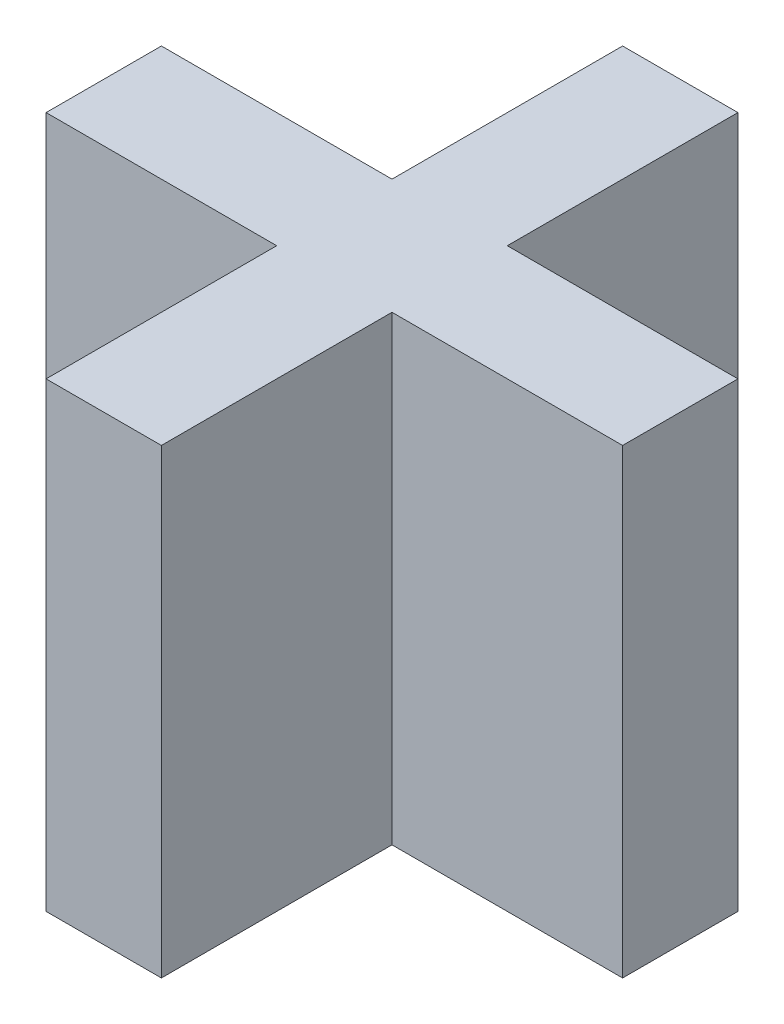
from build123d import *

# Parameters (mm, degrees)
CRUZ_DEPTH                 = 100
CROQUIS_AGUJEROS_MONTAJE_R = 4
AGUJERO_INSERTO_M6_DEPTH   = 14


with BuildPart() as part:
    # Croquis_cruz → Cruz (new body)
    with BuildSketch(Plane(origin=(0, 0, 0), x_dir=(1, 0, 0), z_dir=(0, 1, 0))):
        Polygon((-62.5, -12.5), (-12.5, -12.5), (-12.5, -62.5), (12.5, -62.5), (12.5, -12.5), (62.5, -12.5), (62.5, 12.5), (12.5, 12.5), (12.5, 62.5), (-12.5, 62.5), (-12.5, 12.5), (-62.5, 12.5), align=None)
    extrude(amount=CRUZ_DEPTH)

    # Croquis_agujeros_montaje → Agujero_inserto_M6 (cut)
    with BuildSketch(Plane(origin=(0, 0, 0), x_dir=(1, 0, 0), z_dir=(0, 1, 0))):
        with Locations(Location((-50, 0, 0), (0, 0, 270))):
            Circle(CROQUIS_AGUJEROS_MONTAJE_R)
        with Locations(Location((0, 0, 0), (0, 0, 270))):
            Circle(CROQUIS_AGUJEROS_MONTAJE_R)
        with Locations(Location((50, 0, 0), (0, 0, 270))):
            Circle(CROQUIS_AGUJEROS_MONTAJE_R)
    extrude(amount=AGUJERO_INSERTO_M6_DEPTH, mode=Mode.SUBTRACT)


solid = part.part
